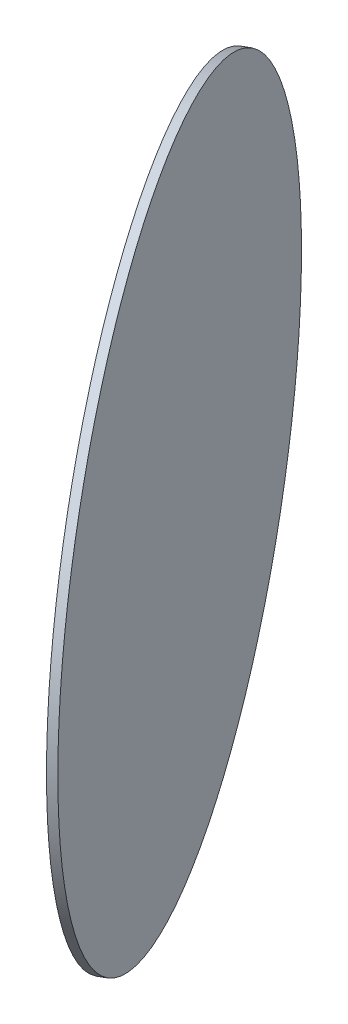
from build123d import *

# Parameters (mm, degrees)
SKETCH1_R             = 40
BOSS_EXTRUDE1_DEPTH   = 1
SCALE1_SCALE          = 0.5
BODY_MOVE_COPY3_ANGLE = 30


with BuildPart() as part:
    # Sketch1 → Boss-Extrude1 (new body)
    with BuildSketch(Plane(origin=(0, 0, 0), x_dir=(0, 0, -1), z_dir=(1, 0, 0))):
        Circle(SKETCH1_R)
    extrude(amount=BOSS_EXTRUDE1_DEPTH)


with BuildPart() as part_1:
    # Scale1: scaled about (0.5, 0, 0)
    add(part.part.scale(SCALE1_SCALE).moved(Location((0.25, 0, 0))))


with BuildPart() as part_2:
    # Body-Move/Copy2: moved
    add(part_1.part.moved(Location((4.171055646, 0, 0))))


with BuildPart() as part_3:
    # Body-Move/Copy3: moved
    add(part_2.part.rotate(Axis((7.238444841, 0, -0.038800486), (0, 1, 0)), BODY_MOVE_COPY3_ANGLE))


solid = part_3.part
